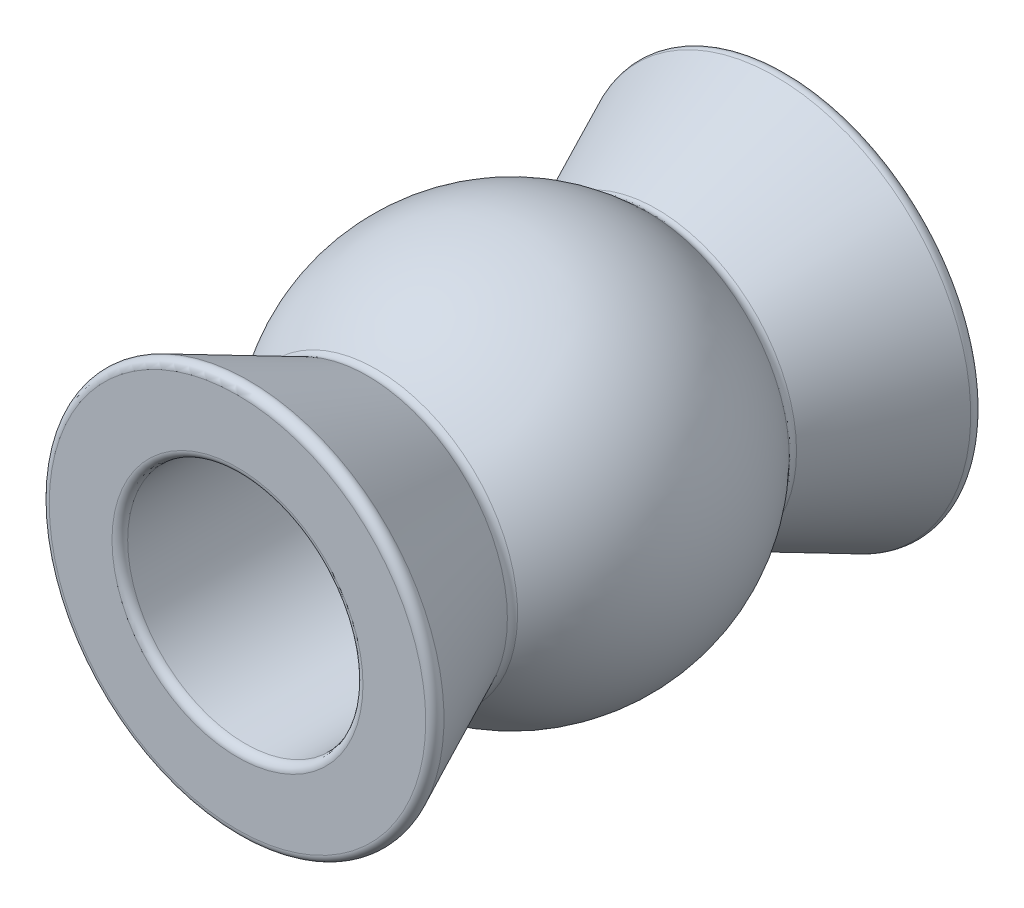
from build123d import *


with BuildPart() as part:
    # Sketch1 → Revolve1 (revolve)
    with BuildSketch(Plane(origin=(0, 0, 0), x_dir=(0, 0, -1), z_dir=(1, 0, 0)), mode=Mode.PRIVATE) as revolve1_sk:
        with BuildLine():
            Line((-3.5, 2.4), (-3.5, 1.6))
            ThreePointArc((-3.5, 1.6), (-3.470710678, 1.529289322), (-3.4, 1.5))
            Line((-3.4, 1.5), (3.4, 1.5))
            ThreePointArc((3.4, 1.5), (3.470710678, 1.529289322), (3.5, 1.6))
            Line((3.5, 1.6), (3.5, 2.4))
            ThreePointArc((3.5, 2.4), (3.453729961, 2.484339145), (3.357738174, 2.490630779))
            Line((3.357738174, 2.490630779), (1.843371688, 1.784470089))
            ThreePointArc((1.843371688, 1.784470089), (1.784736833, 1.776450354), (1.731836406, 1.802981604))
            ThreePointArc((1.731836406, 1.802981604), (0, 2.5), (-1.731836406, 1.802981604))
            ThreePointArc((-1.731836406, 1.802981604), (-1.784736833, 1.776450354), (-1.843371688, 1.784470089))
            Line((-1.843371688, 1.784470089), (-3.357738174, 2.490630779))
            ThreePointArc((-3.357738174, 2.490630779), (-3.453729961, 2.484339145), (-3.5, 2.4))
        make_face()
    revolve(revolve1_sk.sketch.rotate(Axis((0, 0, 0), (0, 0, 1)), 90), axis=Axis((0, 0, 0), (0, 0, 1)))


solid = part.part
